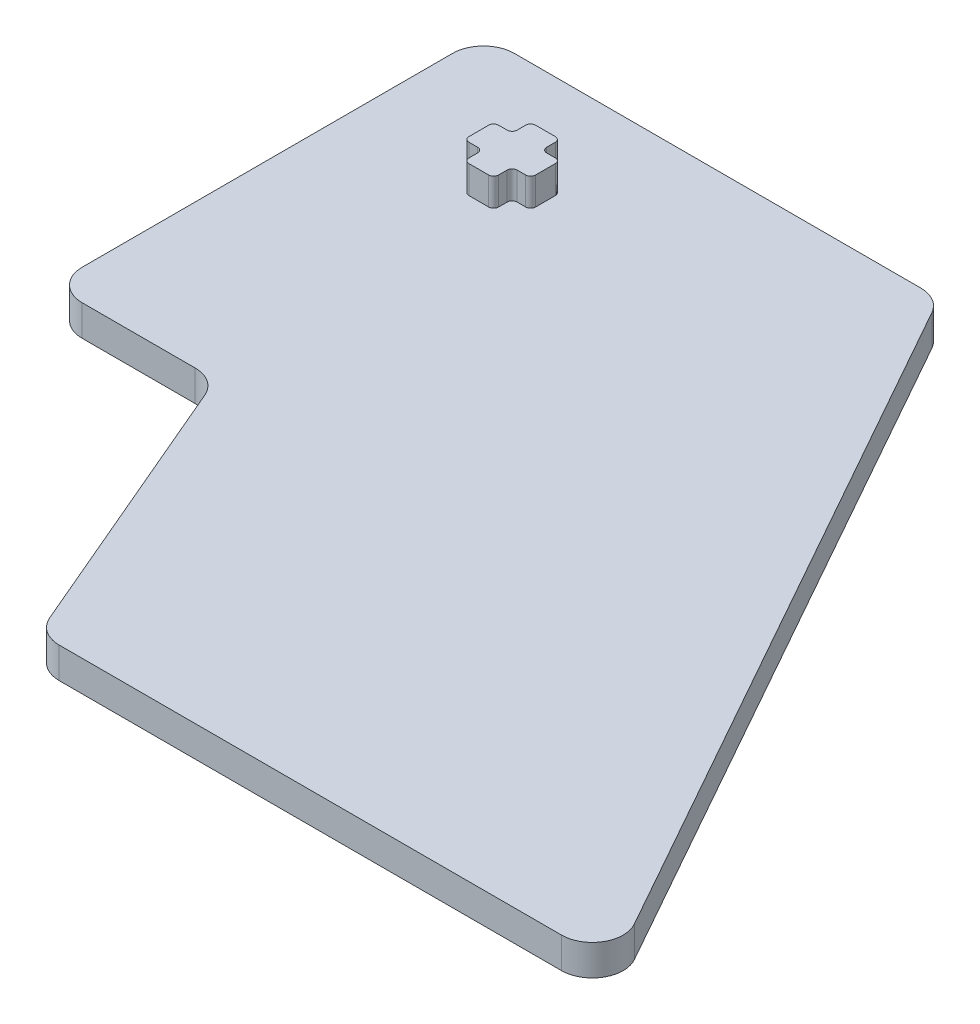
from build123d import *

# Parameters (mm, degrees)
EXTRUDE1_DEPTH = 3.175
EXTRUDE2_DEPTH = 2.8575


with BuildPart() as part:
    # Sketch1 → Extrude1 (new body)
    with BuildSketch(Plane(origin=(0, 0, 0), x_dir=(1, 0, 0), z_dir=(0, 1, 0))):
        with BuildLine():
            Line((3.175, 44.50785877), (45.047498502, 44.50785877))
            ThreePointArc((45.047498502, 44.50785877), (46.651643951, 44.072811758), (47.81618078, 42.886893339))
            Line((47.81618078, 42.886893339), (87.038547596, -26.992036046))
            ThreePointArc((87.038547596, -26.992036046), (87.009818306, -30.150216064), (84.269865318, -31.721070615))
            Line((84.269865318, -31.721070615), (32.528914715, -31.721070615))
            ThreePointArc((32.528914715, -31.721070615), (30.778624678, -31.195053398), (29.608292243, -29.791297251))
            Line((29.608292243, -29.791297251), (17.72934795, -1.929773364))
            ThreePointArc((17.72934795, -1.929773364), (16.559015516, -0.526017217), (14.808725478, 0))
            Line((14.808725478, 0), (3.175, 0))
            ThreePointArc((3.175, 0), (0.92993597, 0.92993597), (0, 3.175))
            Line((0, 3.175), (0, 41.33285877))
            ThreePointArc((0, 41.33285877), (0.92993597, 43.5779228), (3.175, 44.50785877))
        make_face()
        with BuildLine():
            Line((13.029814646, 30.876332876), (13.029814646, 29.987332876))
            ThreePointArc((13.029814646, 29.987332876), (13.178604401, 29.628122631), (13.537814646, 29.479332876))
            Line((13.537814646, 29.479332876), (15.569814646, 29.479332876))
            ThreePointArc((15.569814646, 29.479332876), (15.929024891, 29.628122631), (16.077814646, 29.987332876))
            Line((16.077814646, 29.987332876), (16.077814646, 30.876332876))
            ThreePointArc((16.077814646, 30.876332876), (16.226604401, 31.235543121), (16.585814646, 31.384332876))
            Line((16.585814646, 31.384332876), (17.474814646, 31.384332876))
            ThreePointArc((17.474814646, 31.384332876), (17.834024891, 31.533122631), (17.982814646, 31.892332876))
            Line((17.982814646, 31.892332876), (17.982814646, 33.924332876))
            ThreePointArc((17.982814646, 33.924332876), (17.834024891, 34.283543121), (17.474814646, 34.432332876))
            Line((17.474814646, 34.432332876), (16.585814646, 34.432332876))
            ThreePointArc((16.585814646, 34.432332876), (16.226604401, 34.581122631), (16.077814646, 34.940332876))
            Line((16.077814646, 34.940332876), (16.077814646, 35.829332876))
            ThreePointArc((16.077814646, 35.829332876), (15.929024891, 36.188543121), (15.569814646, 36.337332876))
            Line((15.569814646, 36.337332876), (13.537814646, 36.337332876))
            ThreePointArc((13.537814646, 36.337332876), (13.178604401, 36.188543121), (13.029814646, 35.829332876))
            Line((13.029814646, 35.829332876), (13.029814646, 34.940332876))
            ThreePointArc((13.029814646, 34.940332876), (12.881024891, 34.581122631), (12.521814646, 34.432332876))
            Line((12.521814646, 34.432332876), (11.632814646, 34.432332876))
            ThreePointArc((11.632814646, 34.432332876), (11.273604401, 34.283543121), (11.124814646, 33.924332876))
            Line((11.124814646, 33.924332876), (11.124814646, 31.892332876))
            ThreePointArc((11.124814646, 31.892332876), (11.273604401, 31.533122631), (11.632814646, 31.384332876))
            Line((11.632814646, 31.384332876), (12.521814646, 31.384332876))
            ThreePointArc((12.521814646, 31.384332876), (12.881024891, 31.235543121), (13.029814646, 30.876332876))
        make_face(mode=Mode.SUBTRACT)
    extrude(amount=-EXTRUDE1_DEPTH)

    # Sketch4 → Extrude2 (add, symmetric)
    with BuildSketch(Plane(origin=(0, 0, 0), x_dir=(1, 0, 0), z_dir=(0, 1, 0))):
        with BuildLine():
            Line((15.569814646, 36.337332876), (13.537814646, 36.337332876))
            ThreePointArc((13.537814646, 36.337332876), (13.178604401, 36.188543121), (13.029814646, 35.829332876))
            Line((13.029814646, 35.829332876), (13.029814646, 34.940332876))
            ThreePointArc((13.029814646, 34.940332876), (12.881024891, 34.581122631), (12.521814646, 34.432332876))
            Line((12.521814646, 34.432332876), (11.632814646, 34.432332876))
            ThreePointArc((11.632814646, 34.432332876), (11.273604401, 34.283543121), (11.124814646, 33.924332876))
            Line((11.124814646, 33.924332876), (11.124814646, 31.892332876))
            ThreePointArc((11.124814646, 31.892332876), (11.273604401, 31.533122631), (11.632814646, 31.384332876))
            Line((11.632814646, 31.384332876), (12.521814646, 31.384332876))
            ThreePointArc((12.521814646, 31.384332876), (12.881024891, 31.235543121), (13.029814646, 30.876332876))
            Line((13.029814646, 30.876332876), (13.029814646, 29.987332876))
            ThreePointArc((13.029814646, 29.987332876), (13.178604401, 29.628122631), (13.537814646, 29.479332876))
            Line((13.537814646, 29.479332876), (15.569814646, 29.479332876))
            ThreePointArc((15.569814646, 29.479332876), (15.929024891, 29.628122631), (16.077814646, 29.987332876))
            Line((16.077814646, 29.987332876), (16.077814646, 30.876332876))
            ThreePointArc((16.077814646, 30.876332876), (16.226604401, 31.235543121), (16.585814646, 31.384332876))
            Line((16.585814646, 31.384332876), (17.474814646, 31.384332876))
            ThreePointArc((17.474814646, 31.384332876), (17.834024891, 31.533122631), (17.982814646, 31.892332876))
            Line((17.982814646, 31.892332876), (17.982814646, 33.924332876))
            ThreePointArc((17.982814646, 33.924332876), (17.834024891, 34.283543121), (17.474814646, 34.432332876))
            Line((17.474814646, 34.432332876), (16.585814646, 34.432332876))
            ThreePointArc((16.585814646, 34.432332876), (16.226604401, 34.581122631), (16.077814646, 34.940332876))
            Line((16.077814646, 34.940332876), (16.077814646, 35.829332876))
            ThreePointArc((16.077814646, 35.829332876), (15.929024891, 36.188543121), (15.569814646, 36.337332876))
        make_face()
    extrude(amount=EXTRUDE2_DEPTH, both=True)


solid = part.part
